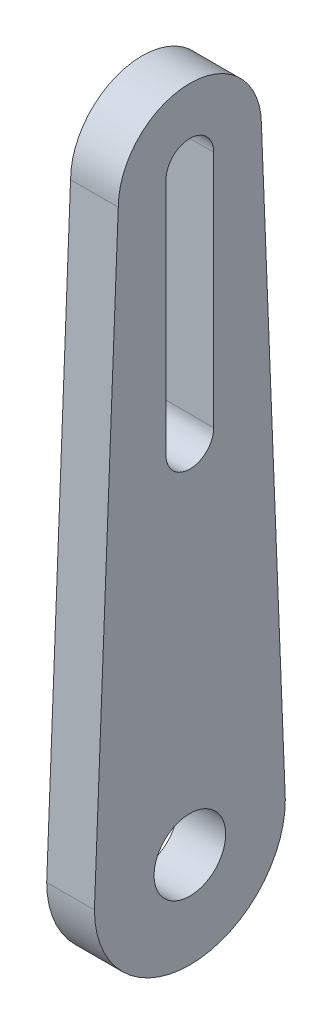
from build123d import *

# Parameters (mm, degrees)
SKETCH1_R           = 3
BOSS_EXTRUDE1_DEPTH = 2


with BuildPart() as part:
    # Sketch1 → Boss-Extrude1 (new, symmetric)
    with BuildSketch(Plane(origin=(0, 0, 0), x_dir=(0, 0, -1), z_dir=(1, 0, 0))):
        with BuildLine():
            Line((-8, 0), (-6, 50))
            ThreePointArc((-6, 50), (0, 56), (6, 50))
            Line((6, 50), (8, 0))
            ThreePointArc((8, 0), (0, -8), (-8, 0))
        make_face()
        Circle(SKETCH1_R, mode=Mode.SUBTRACT)
        with BuildLine():
            Line((2, 50), (2, 30))
            ThreePointArc((2, 30), (0, 28), (-2, 30))
            Line((-2, 30), (-2, 50))
            ThreePointArc((-2, 50), (0, 52), (2, 50))
        make_face(mode=Mode.SUBTRACT)
    extrude(amount=BOSS_EXTRUDE1_DEPTH, both=True)


solid = part.part
